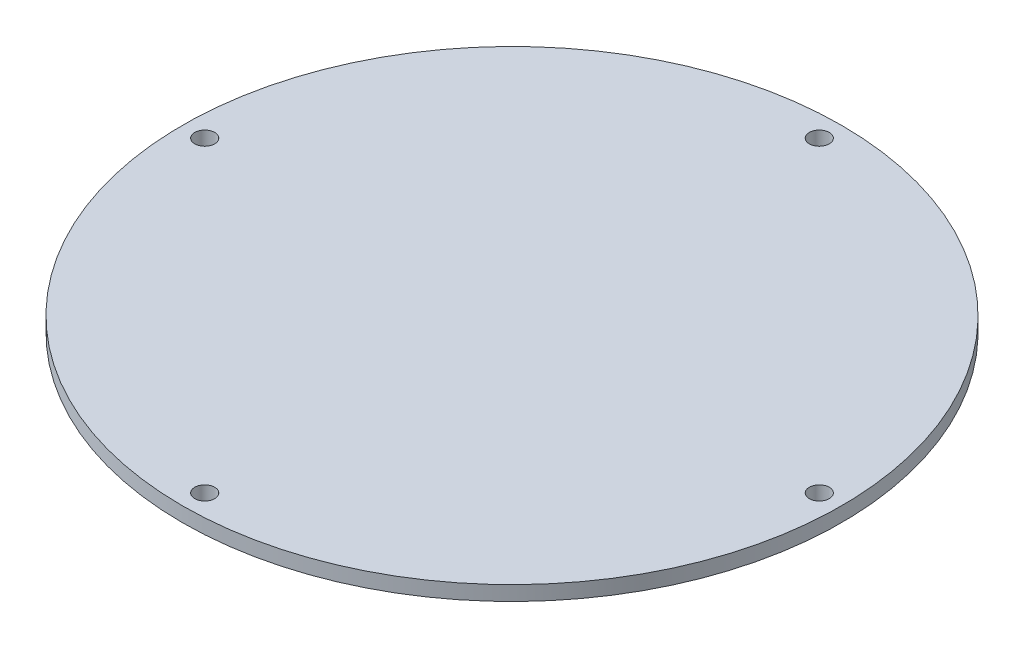
from build123d import *

# Parameters (mm, degrees)
SKETCH1_R             = 57.15
BOSS_EXTRUDE1_DEPTH   = 2.54
F_8_32_TAPPED_HOLE1_D = 3.4544
CIRPATTERN1_COUNT     = 4


with BuildPart() as part:
    # Sketch1 → Boss-Extrude1 (new body)
    with BuildSketch(Plane(origin=(0, 0, 0), x_dir=(1, 0, 0), z_dir=(0, 1, 0))):
        with Locations(Location((0, 0, 0), (0, 0, 270))):
            Circle(SKETCH1_R)
    extrude(amount=BOSS_EXTRUDE1_DEPTH)

    # #8-32 Tapped Hole1 (through all)
    with Locations(Plane(origin=(0, 2.54, 0), x_dir=(1, 0, 0), z_dir=(0, 1, 0))):
        with Locations((-53.28626023, 0)):
            f_8_32_tapped_hole1 = Hole(F_8_32_TAPPED_HOLE1_D / 2)

    # CirPattern1: #8-32 Tapped Hole1 ×4 about axis
    cirpattern1_axis = Axis((0, 0, 0), (0, 1, 0))
    for i in range(1, CIRPATTERN1_COUNT):
        add(f_8_32_tapped_hole1.rotate(cirpattern1_axis, i * 360 / CIRPATTERN1_COUNT), mode=Mode.SUBTRACT)


solid = part.part
